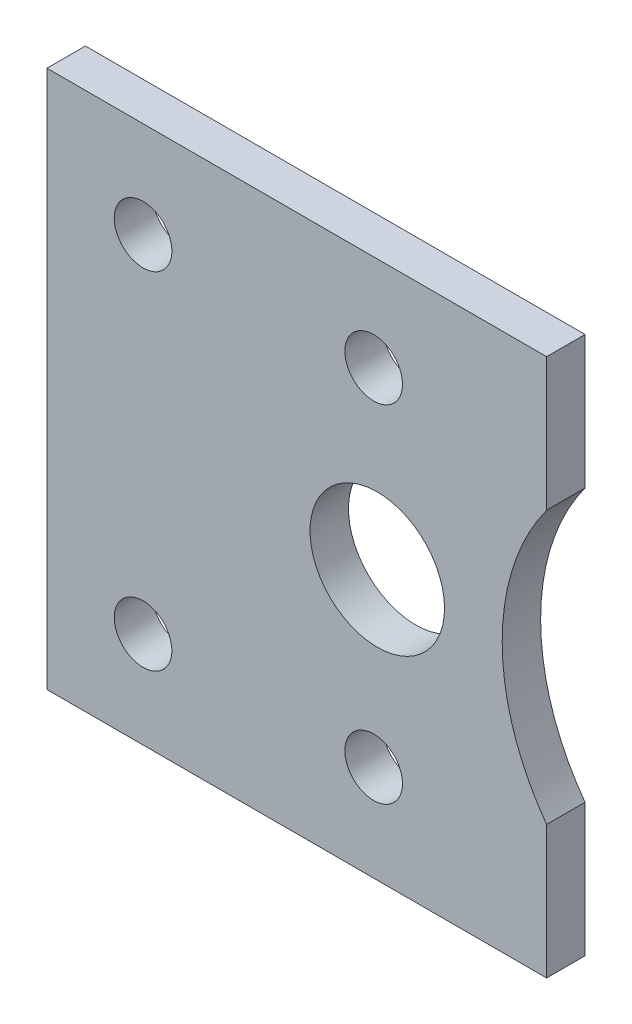
from build123d import *

# Parameters (mm, degrees)
SZKIC1_R                    = 3.5
SZKIC1_R_2                  = 1.5
DODANIE_WYCI_GNI_CIE1_DEPTH = 2


with BuildPart() as part:
    # Szkic1 → Dodanie-wyciągnięcie1 (new body)
    with BuildSketch(Plane.XY):
        with BuildLine():
            Line((0, 0), (0, 28))
            Line((0, 28), (26, 28))
            Line((26, 28), (26, 21.080196399))
            ThreePointArc((26, 21.080196399), (23.68869542, 14), (26, 6.919803601))
            Line((26, 6.919803601), (26, 0))
            Line((26, 0), (0, 0))
        make_face()
        with Locations((17.18869542, 14)):
            Circle(SZKIC1_R, mode=Mode.SUBTRACT)
        with Locations((17, 5)):
            Circle(SZKIC1_R_2, mode=Mode.SUBTRACT)
        with Locations((5, 5)):
            Circle(SZKIC1_R_2, mode=Mode.SUBTRACT)
        with Locations(Location((17, 23, 0), (0, 0, 180))):
            Circle(SZKIC1_R_2, mode=Mode.SUBTRACT)
        with Locations(Location((5, 23, 0), (0, 0, 180))):
            Circle(SZKIC1_R_2, mode=Mode.SUBTRACT)
    extrude(amount=DODANIE_WYCI_GNI_CIE1_DEPTH)


solid = part.part
